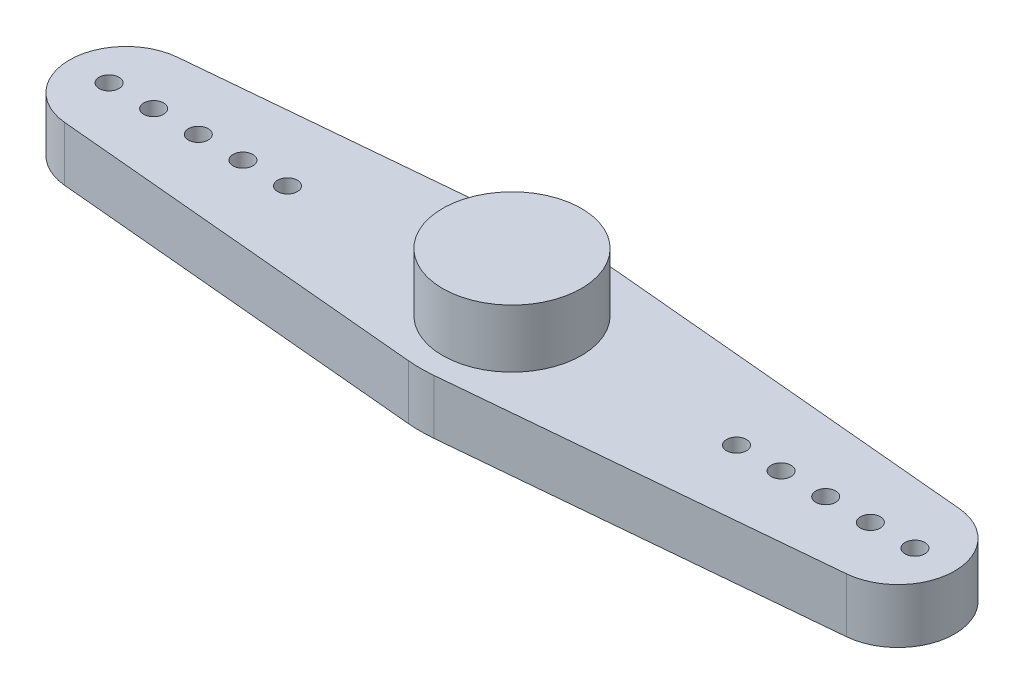
from build123d import *

# Parameters (mm, degrees)
SKETCH1_R           = 0.7
BOSS_EXTRUDE1_DEPTH = 3.85
FILLET1_R           = 10
SKETCH2_R           = 4.9
BOSS_EXTRUDE2_DEPTH = 4.1


with BuildPart() as part:
    # Sketch1 → Boss-Extrude1 (new body)
    with BuildSketch(Plane(origin=(0, 0, 0), x_dir=(1, 0, 0), z_dir=(0, 1, 0))):
        with BuildLine():
            Line((27.613034708, 3.983491659), (0, 6.5))
            Line((0, 6.5), (-27.613034708, 3.983491659))
            ThreePointArc((-27.613034708, 3.983491659), (-31.25, 0), (-27.613034708, -3.983491659))
            Line((-27.613034708, -3.983491659), (0, -6.5))
            Line((0, -6.5), (27.613034708, -3.983491659))
            ThreePointArc((27.613034708, -3.983491659), (31.25, 0), (27.613034708, 3.983491659))
        make_face()
        with Locations(Location((28.45, 0, 0), (0, 0, 90))):
            Circle(SKETCH1_R, mode=Mode.SUBTRACT)
        with Locations(Location((25.3, 0, 0), (0, 0, 90))):
            Circle(SKETCH1_R, mode=Mode.SUBTRACT)
        with Locations(Location((22.15, 0, 0), (0, 0, 90))):
            Circle(SKETCH1_R, mode=Mode.SUBTRACT)
        with Locations(Location((19, 0, 0), (0, 0, 90))):
            Circle(SKETCH1_R, mode=Mode.SUBTRACT)
        with Locations(Location((15.85, 0, 0), (0, 0, 90))):
            Circle(SKETCH1_R, mode=Mode.SUBTRACT)
        with Locations(Location((-15.85, 0, 0), (0, 0, 90))):
            Circle(SKETCH1_R, mode=Mode.SUBTRACT)
        with Locations(Location((-19, 0, 0), (0, 0, 90))):
            Circle(SKETCH1_R, mode=Mode.SUBTRACT)
        with Locations(Location((-22.15, 0, 0), (0, 0, 90))):
            Circle(SKETCH1_R, mode=Mode.SUBTRACT)
        with Locations(Location((-25.3, 0, 0), (0, 0, 90))):
            Circle(SKETCH1_R, mode=Mode.SUBTRACT)
        with Locations(Location((-28.45, 0, 0), (0, 0, 90))):
            Circle(SKETCH1_R, mode=Mode.SUBTRACT)
    extrude(amount=BOSS_EXTRUDE1_DEPTH)

    # Fillet1
    fillet1_edges = [part.edges().sort_by_distance(p)[0] for p in [
        (0, 1.925, 6.5),
        (0, 1.925, -6.5),
    ]]
    fillet(fillet1_edges, radius=FILLET1_R)

    # Sketch2 → Boss-Extrude2 (add)
    with BuildSketch(Plane(origin=(0, 3.85, 0), x_dir=(1, 0, 0), z_dir=(0, 1, 0))):
        with Locations(Location((0, 0, 0), (0, 0, 270))):
            Circle(SKETCH2_R)
    extrude(amount=BOSS_EXTRUDE2_DEPTH)


solid = part.part
